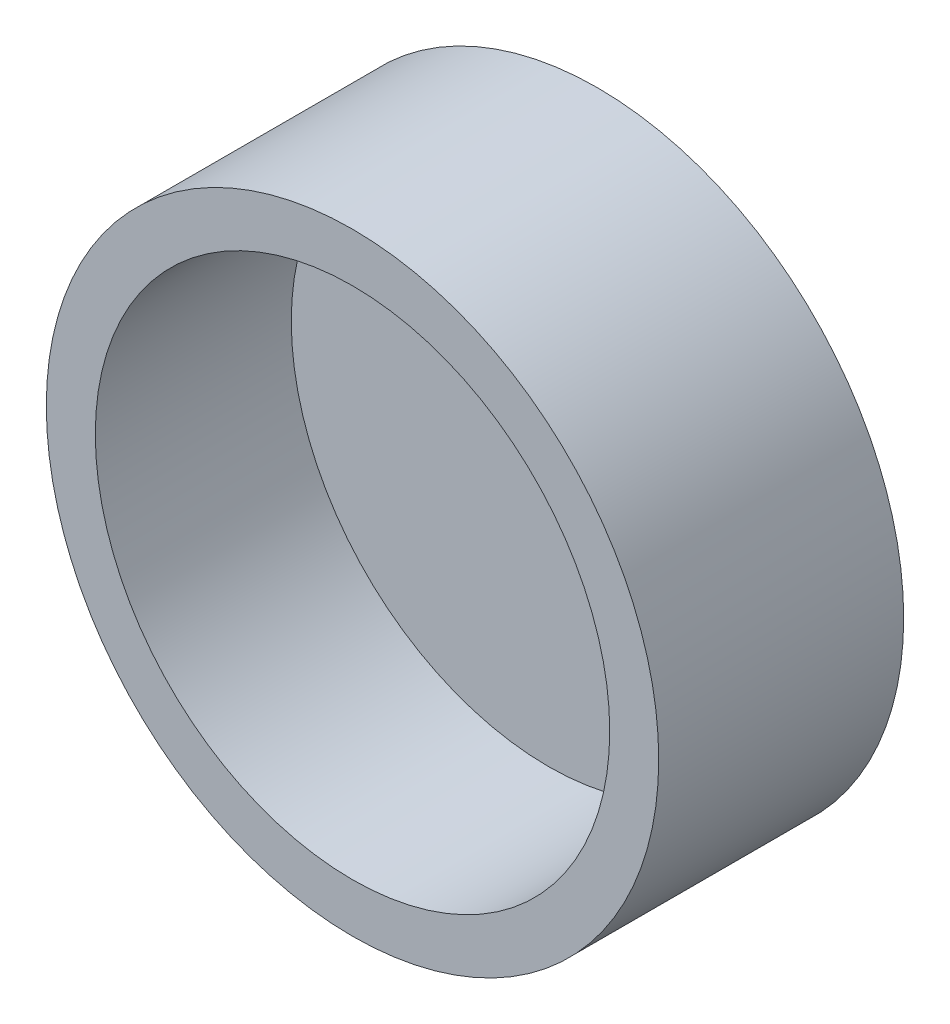
from build123d import *

# Parameters (mm, degrees)
SKETCH1_R           = 15.875
BOSS_EXTRUDE1_DEPTH = 12.7
SHELL1_T            = -2.54


with BuildPart() as part:
    # Sketch1 → Boss-Extrude1 (new body)
    with BuildSketch(Plane.XY):
        Circle(SKETCH1_R)
    extrude(amount=BOSS_EXTRUDE1_DEPTH)

    # Shell1
    shell1_openings = [part.faces().sort_by_distance(p)[0] for p in [
        (0, 0, 12.7),
    ]]
    offset(amount=SHELL1_T, openings=shell1_openings, kind=Kind.INTERSECTION)


solid = part.part
